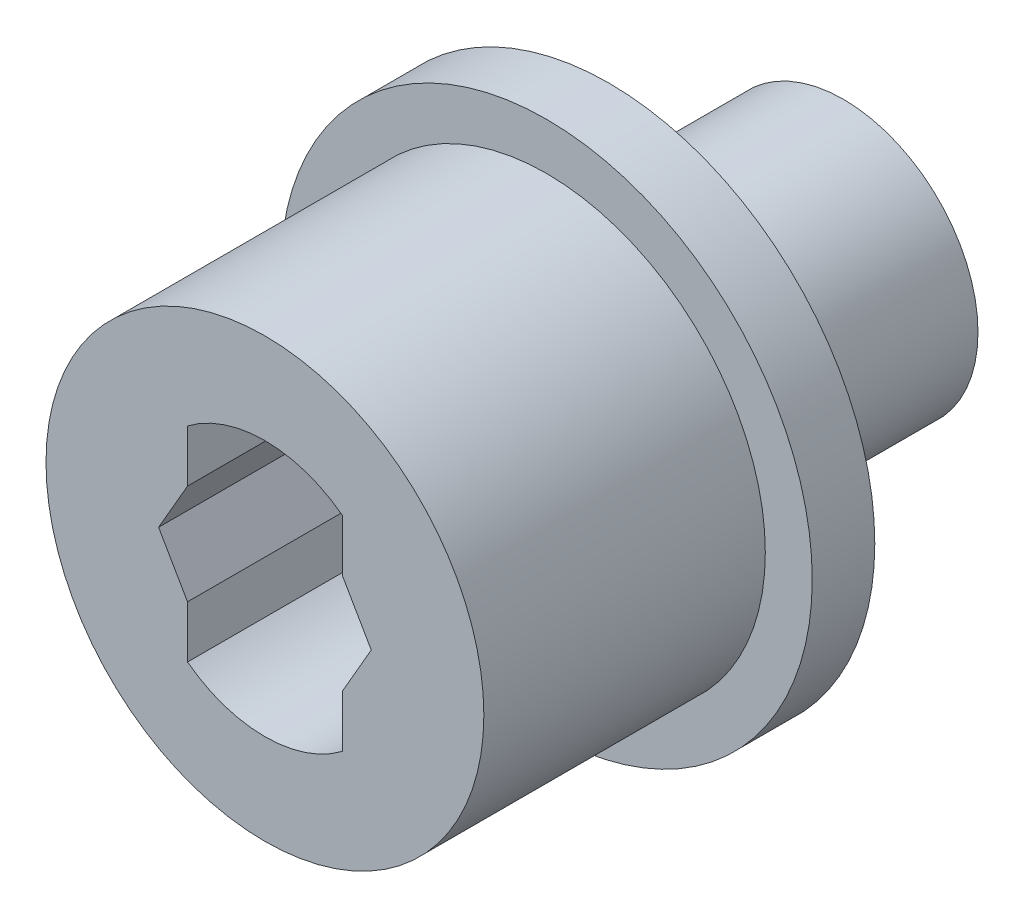
from build123d import *

# Parameters (mm, degrees)
SKETCH1_R               = 7
SKETCH1_R_2             = 4.1
BOSS_EXTRUDE1_DEPTH     = 9
SKETCH5_R               = 8.5
BOSS_EXTRUDE3_DEPTH     = 2
CUT_EXTRUDE4_DEPTH      = 16.016657418
SKETCH10_R              = 4.3
BOSS_EXTRUDE4_DEPTH     = 7.5
CUT_EXTRUDE8_DEPTH      = 17.294170737
CUT_EXTRUDE8_DEPTH_BACK = 1
SKETCH6_R               = 3.45


with BuildPart() as part:
    # Sketch1 → Boss-Extrude1 (new body)
    # profile 1 of 3: a face of its own
    with BuildSketch(Plane.XY):
        Circle(SKETCH1_R)
        Circle(SKETCH1_R_2, mode=Mode.SUBTRACT)
    # profile 2 of 3: a face of its own
    with BuildSketch(Plane.XY):
        with BuildLine():
            Line((-2.475, -3.268696223), (-2.475, 3.268696223))
            ThreePointArc((-2.475, 3.268696223), (-4.1, 0), (-2.475, -3.268696223))
        make_face()
    # profile 3 of 3: a face of its own
    with BuildSketch(Plane.XY):
        with BuildLine():
            ThreePointArc((4.1, 0), (3.671341717, 1.825171225), (2.475, 3.268696223))
            Line((2.475, 3.268696223), (2.475, -3.268696223))
            ThreePointArc((2.475, -3.268696223), (3.671341717, -1.825171225), (4.1, 0))
        make_face()
    extrude(amount=BOSS_EXTRUDE1_DEPTH)

    # Sketch5 → Boss-Extrude3 (add)
    with BuildSketch(Plane(origin=(0, 0, 0), x_dir=(-1, 0, 0), z_dir=(0, 0, -1))):
        Circle(SKETCH5_R)
    extrude(amount=BOSS_EXTRUDE3_DEPTH)

    # Sketch9 → Cut-Extrude4 (cut, through all)
    with BuildSketch(Plane.XY):
        Polygon((-3.4, 0), (-1.7, -2.944486373), (1.7, -2.944486373), (3.4, 0), (1.7, 2.944486373), (-1.7, 2.944486373), align=None)
    extrude(amount=CUT_EXTRUDE4_DEPTH, mode=Mode.SUBTRACT)

    # Sketch10 → Boss-Extrude4 (add)
    with BuildSketch(Plane(origin=(0, 0, -2), x_dir=(-1, 0, 0), z_dir=(0, 0, -1))):
        Circle(SKETCH10_R)
    extrude(amount=BOSS_EXTRUDE4_DEPTH)

    # Sketch6 → Cut-Extrude8 (cut, two sides: drawn at the far end of the back side and taken through both)
    with BuildSketch(Plane(origin=(0, 0, -2), x_dir=(-1, 0, 0), z_dir=(0, 0, -1)).offset(-CUT_EXTRUDE8_DEPTH_BACK)):
        Circle(SKETCH6_R)
    extrude(amount=CUT_EXTRUDE8_DEPTH + CUT_EXTRUDE8_DEPTH_BACK, mode=Mode.SUBTRACT)


solid = part.part
